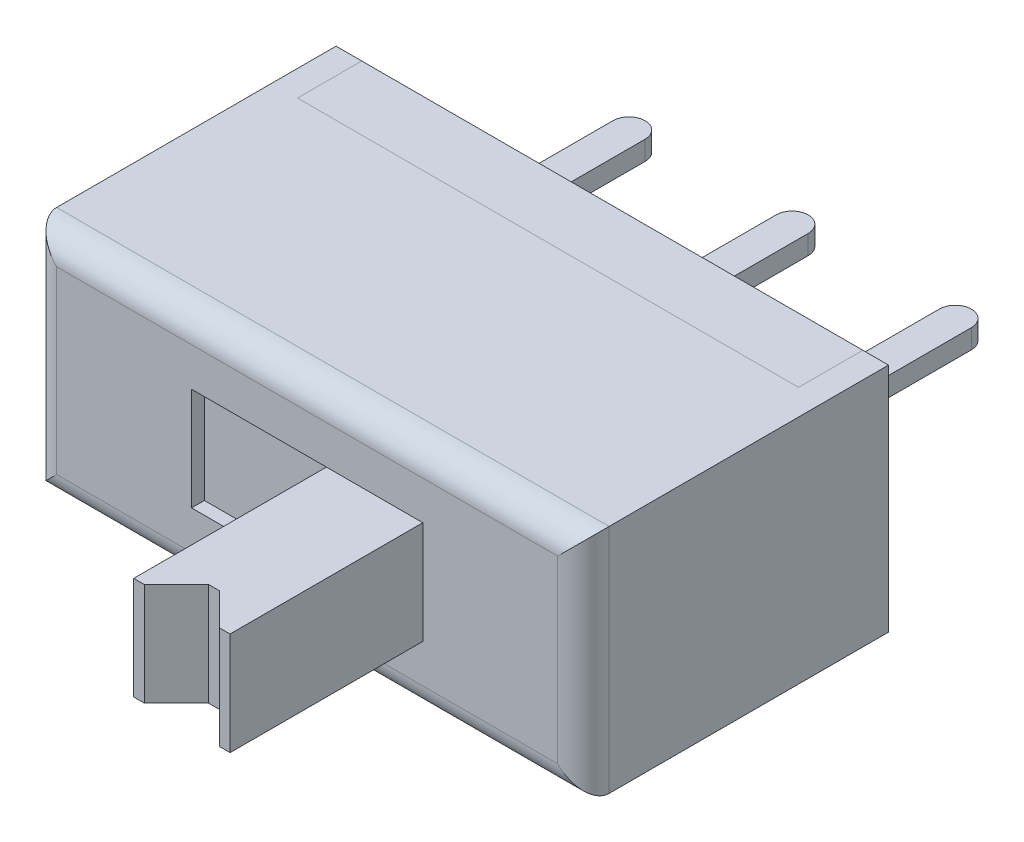
from build123d import *

# Parameters (mm, degrees)
SKETCH1_W                         = 8.6
SKETCH1_H                         = 3.6
BOSS_EXTRUDE1_DEPTH               = 4.75
FILLET2_R                         = 0.4
SKETCH2_W                         = 3.6
SKETCH2_H                         = 1.6
CUT_EXTRUDE1_DEPTH                = 0.2
BOSS_EXTRUDE2_DEPTH               = 1.6
SKETCH8_W                         = 7.8
SKETCH8_H                         = 3.6
CUT_EXTRUDE2_DEPTH                = 1
SKETCH10_W                        = 0.5
SKETCH10_H                        = 0.3
BOSS_EXTRUDE6_DEPTH               = 4.05
FILLET5_RADIUS                    = 0.25
FILLET5_LENGTH                    = 0.3
LPATTERN3_COUNT                   = 2
LPATTERN3_PITCH                   = 2.54
FILLET5_OF_LPATTERN3_2_RADIUS     = 0.25
FILLET5_OF_LPATTERN3_2_LENGTH     = 0.3
LPATTERN3_COL_COUNT               = 2
LPATTERN3_COL_PITCH               = 2.54
FILLET5_OF_LPATTERN3_COL_2_RADIUS = 0.25
FILLET5_OF_LPATTERN3_COL_2_LENGTH = 0.3
SKETCH9_W                         = 7.8
SKETCH9_H                         = 3.6
BOSS_EXTRUDE7_DEPTH               = 1


with BuildPart() as part:
    # Sketch1 → Boss-Extrude1 (new body)
    with BuildSketch(Plane.XY):
        Rectangle(SKETCH1_W, SKETCH1_H)
    extrude(amount=BOSS_EXTRUDE1_DEPTH)

    # Fillet2
    fillet2_edges = [part.edges().sort_by_distance(p)[0] for p in [
        (-4.3, 0, 4.75),
        (0, -1.8, 4.75),
        (4.3, 0, 4.75),
        (0, 1.8, 4.75),
    ]]
    fillet(fillet2_edges, radius=FILLET2_R)

    # Sketch2 → Cut-Extrude1 (cut)
    with BuildSketch(Plane.XY.offset(4.75)):
        Rectangle(SKETCH2_W, SKETCH2_H)
    extrude(amount=-CUT_EXTRUDE1_DEPTH, mode=Mode.SUBTRACT)

    # Sketch4 → Boss-Extrude2 (add)
    with BuildSketch(Plane(origin=(0, -0.8, 0), x_dir=(1, 0, 0), z_dir=(0, 1, 0))):
        Polygon((1.8, -4.55), (1.8, -7.75), (1.633333333, -7.75), (1.133333333, -7.25), (0.966666667, -7.25), (0.466666667, -7.75), (0.3, -7.75), (0.3, -4.55), align=None)
    extrude(amount=BOSS_EXTRUDE2_DEPTH)

    # Sketch8 → Cut-Extrude2 (cut)
    with BuildSketch(Plane(origin=(0, 0, 0), x_dir=(-1, 0, 0), z_dir=(0, 0, -1))):
        Rectangle(SKETCH8_W, SKETCH8_H)
    extrude(amount=-CUT_EXTRUDE2_DEPTH, mode=Mode.SUBTRACT)

    # Sketch10 → Boss-Extrude6 (add)
    with BuildSketch(Plane(origin=(0, 0, 1), x_dir=(-1, 0, 0), z_dir=(0, 0, -1))):
        Rectangle(SKETCH10_W, SKETCH10_H)
    boss_extrude6 = extrude(amount=BOSS_EXTRUDE6_DEPTH)

    # Fillet5: full round fillet: the end face becomes a half cylinder, R = half its width
    fillet5_face = Plane((0, 0, -3.05), x_dir=(0, -1, 0), z_dir=(0, 0, -1))  # on the end face: x along it, z out of the body
    fillet5_slab = fillet5_face.offset(-FILLET5_RADIUS / 2) * Box(FILLET5_LENGTH, 2 * FILLET5_RADIUS, FILLET5_RADIUS, mode=Mode.PRIVATE)  # the body's end, R deep
    fillet5_round = Plane((0, 0, -2.8), x_dir=(0, 0, -1), z_dir=(0, -1, 0)) * Cylinder(FILLET5_RADIUS, FILLET5_LENGTH, mode=Mode.PRIVATE)  # its axis R under the face
    add(fillet5_slab - fillet5_round, mode=Mode.SUBTRACT)

    # LPattern3: Boss-Extrude6 ×2
    with Locations(*[(i * LPATTERN3_PITCH, 0, 0) for i in range(1, LPATTERN3_COUNT)]):
        add(boss_extrude6)

    # Fillet5 of LPattern3 2: full round fillet: the end face becomes a half cylinder, R = half its width
    fillet5_of_lpattern3_2_face = Plane((2.54, 0, -3.05), x_dir=(0, -1, 0), z_dir=(0, 0, -1))  # on the end face: x along it, z out of the body
    fillet5_of_lpattern3_2_slab = fillet5_of_lpattern3_2_face.offset(-FILLET5_OF_LPATTERN3_2_RADIUS / 2) * Box(FILLET5_OF_LPATTERN3_2_LENGTH, 2 * FILLET5_OF_LPATTERN3_2_RADIUS, FILLET5_OF_LPATTERN3_2_RADIUS, mode=Mode.PRIVATE)  # the body's end, R deep
    fillet5_of_lpattern3_2_round = Plane((2.54, 0, -2.8), x_dir=(0, 0, -1), z_dir=(0, -1, 0)) * Cylinder(FILLET5_OF_LPATTERN3_2_RADIUS, FILLET5_OF_LPATTERN3_2_LENGTH, mode=Mode.PRIVATE)  # its axis R under the face
    add(fillet5_of_lpattern3_2_slab - fillet5_of_lpattern3_2_round, mode=Mode.SUBTRACT)

    # LPattern3 col: Boss-Extrude6 ×2
    with Locations(*[(-i * LPATTERN3_COL_PITCH, 0, 0) for i in range(1, LPATTERN3_COL_COUNT)]):
        add(boss_extrude6)

    # Fillet5 of LPattern3 col 2: full round fillet: the end face becomes a half cylinder, R = half its width
    fillet5_of_lpattern3_col_2_face = Plane((-2.54, 0, -3.05), x_dir=(0, -1, 0), z_dir=(0, 0, -1))  # on the end face: x along it, z out of the body
    fillet5_of_lpattern3_col_2_slab = fillet5_of_lpattern3_col_2_face.offset(-FILLET5_OF_LPATTERN3_COL_2_RADIUS / 2) * Box(FILLET5_OF_LPATTERN3_COL_2_LENGTH, 2 * FILLET5_OF_LPATTERN3_COL_2_RADIUS, FILLET5_OF_LPATTERN3_COL_2_RADIUS, mode=Mode.PRIVATE)  # the body's end, R deep
    fillet5_of_lpattern3_col_2_round = Plane((-2.54, 0, -2.8), x_dir=(0, 0, -1), z_dir=(0, -1, 0)) * Cylinder(FILLET5_OF_LPATTERN3_COL_2_RADIUS, FILLET5_OF_LPATTERN3_COL_2_LENGTH, mode=Mode.PRIVATE)  # its axis R under the face
    add(fillet5_of_lpattern3_col_2_slab - fillet5_of_lpattern3_col_2_round, mode=Mode.SUBTRACT)


with BuildPart() as body_2:
    # Sketch9 → Boss-Extrude7 (new body)
    with BuildSketch(Plane(origin=(0, 0, 1), x_dir=(-1, 0, 0), z_dir=(0, 0, -1))):
        Rectangle(SKETCH9_W, SKETCH9_H)
    extrude(amount=BOSS_EXTRUDE7_DEPTH)


solid = Compound([part.part, body_2.part])
